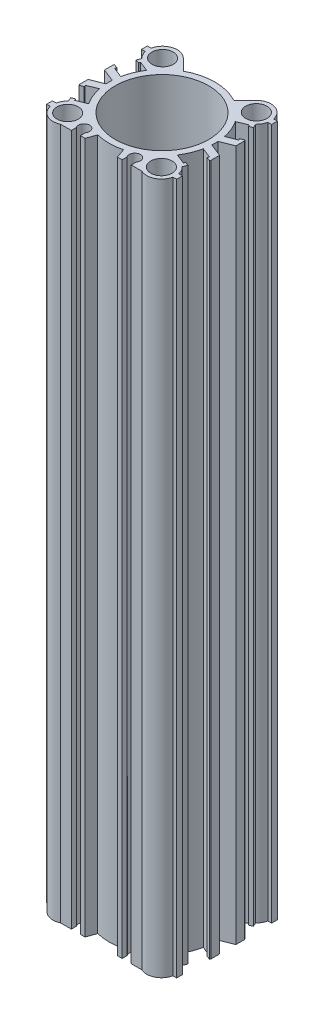
from build123d import *

# Parameters (mm, degrees)
SALIENTE_EXTRUIR1_DEPTH      = 118.5
SALIENTE_EXTRUIR1_DEPTH_BACK = 118.5
CROQUIS1_R                   = 16
CROQUIS1_R_2                 = 3.65


with BuildPart() as part:
    # Croquis1 → Saliente-Extruir1 (new, two sides: drawn at the far end of the back side and taken through both)
    with BuildSketch(Plane(origin=(0, 0, 0), x_dir=(1, 0, 0), z_dir=(0, 1, 0)).offset(-SALIENTE_EXTRUIR1_DEPTH_BACK)):
        with BuildLine():
            Line((22.519467165, 2.803307997), (22.519467165, 5.703307997))
            Line((22.519467165, 5.703307997), (22.360287832, 6.103307997))
            Line((22.360287832, 6.103307997), (21.060287832, 5.585975165))
            Line((21.060287832, 5.585975165), (21.282135886, 5.028495622))
            Line((21.282135886, 5.028495622), (17.782135886, 3.635676459))
            ThreePointArc((17.782135886, 3.635676459), (16.78664035, 6.901536477), (15.197137425, 9.923180644))
            Line((15.197137425, 9.923180644), (18.634927939, 11.291243646))
            Line((18.634927939, 11.291243646), (18.856775994, 10.733764103))
            Line((18.856775994, 10.733764103), (20.064648337, 11.214434887))
            Line((20.064648337, 11.214434887), (19.510028201, 12.608133745))
            ThreePointArc((19.510028201, 12.608133745), (20.45236818, 13.820216674), (20.984473879, 15.260360134))
            Line((20.984473879, 15.260360134), (22.284473879, 15.260360134))
            Line((22.284473879, 15.260360134), (22.284473879, 17.260360134))
            Line((22.284473879, 17.260360134), (20.984473879, 17.260360134))
            ThreePointArc((20.984473879, 17.260360134), (17.580307493, 21.047671527), (12.616069545, 19.912586524))
            Line((12.616069545, 19.912586524), (8.656271571, 15.952788549))
            ThreePointArc((8.656271571, 15.952788549), (0, 18.15), (-8.656271571, 15.952788549))
            Line((-8.656271571, 15.952788549), (-12.616069545, 19.912586524))
            ThreePointArc((-12.616069545, 19.912586524), (-17.580307493, 21.047671527), (-20.984473879, 17.260360134))
            Line((-20.984473879, 17.260360134), (-22.284473879, 17.260360134))
            Line((-22.284473879, 17.260360134), (-22.284473879, 15.260360134))
            Line((-22.284473879, 15.260360134), (-20.984473879, 15.260360134))
            ThreePointArc((-20.984473879, 15.260360134), (-20.45236818, 13.820216674), (-19.510028201, 12.608133745))
            Line((-19.510028201, 12.608133745), (-20.064648337, 11.214434887))
            Line((-20.064648337, 11.214434887), (-18.856775994, 10.733764103))
            Line((-18.856775994, 10.733764103), (-18.634927939, 11.291243646))
            Line((-18.634927939, 11.291243646), (-15.197137425, 9.923180644))
            ThreePointArc((-15.197137425, 9.923180644), (-16.78664035, 6.901536477), (-17.782135886, 3.635676459))
            Line((-17.782135886, 3.635676459), (-21.282135886, 5.028495622))
            Line((-21.282135886, 5.028495622), (-21.060287832, 5.585975165))
            Line((-21.060287832, 5.585975165), (-22.360287832, 6.103307997))
            Line((-22.360287832, 6.103307997), (-22.519467165, 5.703307997))
            Line((-22.519467165, 5.703307997), (-22.519467165, 2.803307997))
            Line((-22.519467165, 2.803307997), (-18.119467165, 1.052335335))
            ThreePointArc((-18.119467165, 1.052335335), (-18.15, 0), (-18.119467165, -1.052335335))
            Line((-18.119467165, -1.052335335), (-22.519467165, -2.803307997))
            Line((-22.519467165, -2.803307997), (-22.519467165, -5.703307997))
            Line((-22.519467165, -5.703307997), (-22.360287832, -6.103307997))
            Line((-22.360287832, -6.103307997), (-21.060287832, -5.585975165))
            Line((-21.060287832, -5.585975165), (-21.282135886, -5.028495622))
            Line((-21.282135886, -5.028495622), (-17.782135886, -3.635676459))
            ThreePointArc((-17.782135886, -3.635676459), (-16.78664035, -6.901536477), (-15.197137425, -9.923180644))
            Line((-15.197137425, -9.923180644), (-18.634927939, -11.291243646))
            Line((-18.634927939, -11.291243646), (-18.856775994, -10.733764103))
            Line((-18.856775994, -10.733764103), (-20.064648337, -11.214434887))
            Line((-20.064648337, -11.214434887), (-19.510028201, -12.608133745))
            ThreePointArc((-19.510028201, -12.608133745), (-20.45236818, -13.820216674), (-20.984473879, -15.260360134))
            Line((-20.984473879, -15.260360134), (-22.284473879, -15.260360134))
            Line((-22.284473879, -15.260360134), (-22.284473879, -17.260360134))
            Line((-22.284473879, -17.260360134), (-20.984473879, -17.260360134))
            ThreePointArc((-20.984473879, -17.260360134), (-18.321863215, -20.745689761), (-13.936329401, -20.809809373))
            Line((-13.936329401, -20.809809373), (-10.255447151, -20.809809373))
            Line((-10.255447151, -20.809809373), (-10.255447151, -19.109809373))
            ThreePointArc((-10.255447151, -19.109809373), (-8.705447151, -16.109151592), (-7.155447151, -19.109809373))
            Line((-7.155447151, -19.109809373), (-7.155447151, -20.809809373))
            Line((-7.155447151, -20.809809373), (-5.555447151, -20.809809373))
            Line((-5.555447151, -20.809809373), (-4.41427266, -17.605019082))
            ThreePointArc((-4.41427266, -17.605019082), (0, -18.15), (4.41427266, -17.605019082))
            Line((4.41427266, -17.605019082), (5.555447151, -20.809809373))
            Line((5.555447151, -20.809809373), (7.155447151, -20.809809373))
            Line((7.155447151, -20.809809373), (7.155447151, -19.109809373))
            ThreePointArc((7.155447151, -19.109809373), (8.705447151, -16.109151592), (10.255447151, -19.109809373))
            Line((10.255447151, -19.109809373), (10.255447151, -20.809809373))
            Line((10.255447151, -20.809809373), (13.936329401, -20.809809373))
            ThreePointArc((13.936329401, -20.809809373), (18.321863215, -20.745689761), (20.984473879, -17.260360134))
            Line((20.984473879, -17.260360134), (22.284473879, -17.260360134))
            Line((22.284473879, -17.260360134), (22.284473879, -15.260360134))
            Line((22.284473879, -15.260360134), (20.984473879, -15.260360134))
            ThreePointArc((20.984473879, -15.260360134), (20.45236818, -13.820216674), (19.510028201, -12.608133745))
            Line((19.510028201, -12.608133745), (20.064648337, -11.214434887))
            Line((20.064648337, -11.214434887), (18.856775994, -10.733764103))
            Line((18.856775994, -10.733764103), (18.634927939, -11.291243646))
            Line((18.634927939, -11.291243646), (15.197137425, -9.923180644))
            ThreePointArc((15.197137425, -9.923180644), (16.78664035, -6.901536477), (17.782135886, -3.635676459))
            Line((17.782135886, -3.635676459), (21.282135886, -5.028495622))
            Line((21.282135886, -5.028495622), (21.060287832, -5.585975165))
            Line((21.060287832, -5.585975165), (22.360287832, -6.103307997))
            Line((22.360287832, -6.103307997), (22.519467165, -5.703307997))
            Line((22.519467165, -5.703307997), (22.519467165, -2.803307997))
            Line((22.519467165, -2.803307997), (18.119467165, -1.052335335))
            ThreePointArc((18.119467165, -1.052335335), (18.15, 0), (18.119467165, 1.052335335))
            Line((18.119467165, 1.052335335), (22.519467165, 2.803307997))
        make_face()
        Circle(CROQUIS1_R, mode=Mode.SUBTRACT)
        with Locations((16.063048873, 16.260360134)):
            Circle(CROQUIS1_R_2, mode=Mode.SUBTRACT)
        with Locations((-16.063048873, 16.260360134)):
            Circle(CROQUIS1_R_2, mode=Mode.SUBTRACT)
        with Locations((-16.063048873, -16.260360134)):
            Circle(CROQUIS1_R_2, mode=Mode.SUBTRACT)
        with Locations((16.063048873, -16.260360134)):
            Circle(CROQUIS1_R_2, mode=Mode.SUBTRACT)
    extrude(amount=SALIENTE_EXTRUIR1_DEPTH + SALIENTE_EXTRUIR1_DEPTH_BACK)


solid = part.part
